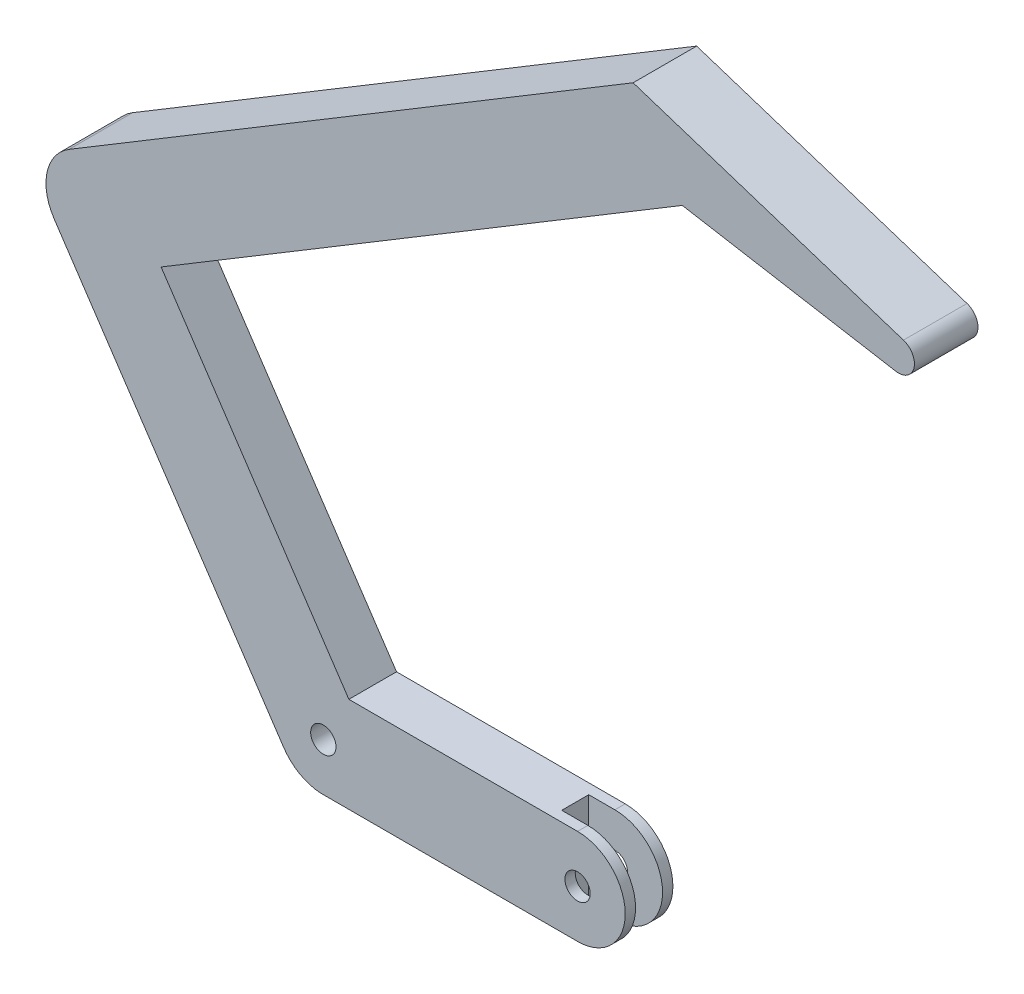
from build123d import *

# Parameters (mm, degrees)
EXTRUDE_1_DEPTH          = 15
CUT_EXTRUDE_1_DEPTH      = 101.747208398
CUT_EXTRUDE_1_DEPTH_BACK = 101.747208398
SKETCH_2_W               = 23.23079143
SKETCH_2_H               = 8.5
CUT_EXTRUDE_2_DEPTH      = 98.33961167
CUT_EXTRUDE_2_DEPTH_BACK = 98.33961167
SKETCH_3_R               = 3.985
EXTRUDE_2_DEPTH          = 15
CUT_EXTRUDE_4_DEPTH      = 157.182605119
CUT_EXTRUDE_4_DEPTH_BACK = 157.182605119
SKETCH_9_R               = 3.985
CUT_EXTRUDE_5_DEPTH      = 157.182605119
CUT_EXTRUDE_5_DEPTH_BACK = 157.182605119
EXTRUDE_5_DEPTH          = 20
FILLET_1_R               = 5


with BuildPart() as part:
    # 草图1 → 凸台-拉伸1 (new body)
    with BuildSketch(Plane.XY):
        with BuildLine():
            Line((0, 15), (80, 15))
            ThreePointArc((80, 15), (95, 0), (80, -15))
            Line((80, -15), (0, -15))
            ThreePointArc((0, -15), (-15, 0), (0, 15))
        make_face()
    extrude(amount=EXTRUDE_1_DEPTH)

    # 草图2 → 切除-拉伸1 (cut, two sides: drawn at the far end of the back side and taken through both)
    with BuildSketch(Plane.XZ.offset(15).offset(-CUT_EXTRUDE_1_DEPTH_BACK)):
        with Locations((83.384604285, 7.5)):
            Rectangle(SKETCH_2_W, SKETCH_2_H)
    extrude(amount=CUT_EXTRUDE_1_DEPTH + CUT_EXTRUDE_1_DEPTH_BACK, mode=Mode.SUBTRACT)

    # 草图3 → 切除-拉伸2 (cut, two sides: drawn at the far end of the back side and taken through both)
    with BuildSketch(Plane(origin=(0, 0, 0), x_dir=(-1, 0, 0), z_dir=(0, 0, -1)).offset(-CUT_EXTRUDE_2_DEPTH_BACK)):
        with Locations((-80, 0)):
            Circle(SKETCH_3_R)
    extrude(amount=CUT_EXTRUDE_2_DEPTH + CUT_EXTRUDE_2_DEPTH_BACK, mode=Mode.SUBTRACT)

    # 草图4 → 凸台-拉伸2 (add)
    with BuildSketch(Plane.XY.offset(15)):
        with BuildLine():
            Line((-12.482779954, -8.354383615), (-84.788603834, 99.682035397))
            ThreePointArc((-84.788603834, 99.682035397), (-80.660207496, 120.519198965), (-59.823043927, 116.390802627))
            Line((-59.823043927, 116.390802627), (12.482779954, 8.354383615))
            ThreePointArc((12.482779954, 8.354383615), (8.354383615, -12.482779954), (-12.482779954, -8.354383615))
        make_face()
    extrude(amount=-EXTRUDE_2_DEPTH)

    # 草图9 → 切除-拉伸4 (cut, two sides: drawn at the far end of the back side and taken through both)
    with BuildSketch(Plane(origin=(0, 0, 0), x_dir=(-1, 0, 0), z_dir=(0, 0, -1)).offset(-CUT_EXTRUDE_4_DEPTH_BACK)):
        Circle(SKETCH_9_R)
    extrude(amount=CUT_EXTRUDE_4_DEPTH + CUT_EXTRUDE_4_DEPTH_BACK, mode=Mode.SUBTRACT)

    # 草图10 → 切除-拉伸5 (cut, two sides: drawn at the far end of the back side and taken through both)
    with BuildSketch(Plane.XY.offset(15).offset(-CUT_EXTRUDE_5_DEPTH_BACK)):
        Polygon((-84.788603834, 99.682035397), (-48.234850364, 123.999680139), (-59.64356033, 141.14900426), (-100.506345589, 113.964745441), (-89.097635623, 96.815421321), align=None)
    extrude(amount=CUT_EXTRUDE_5_DEPTH + CUT_EXTRUDE_5_DEPTH_BACK, mode=Mode.SUBTRACT)

    # 草图11 → 凸台-拉伸5 (add)
    with BuildSketch(Plane.XY.offset(15)):
        with BuildLine():
            Line((97.484212933, 227.748715927), (249.011128895, 178.572894151))
            Line((249.011128895, 178.572894151), (112.956276539, 202.05846487))
            Line((112.956276539, 202.05846487), (-64.546579612, 95.156610362))
            ThreePointArc((-64.546579612, 95.156610362), (-85.127736943, 100.265704087), (-80.018643218, 120.846861419))
            Line((-80.018643218, 120.846861419), (97.484212933, 227.748715927))
        make_face()
    extrude(amount=-EXTRUDE_5_DEPTH)

    # 圆角1
    fillet_1_edges = [part.edges().sort_by_distance(p)[0] for p in [
        (249.011128895, 178.572894151, 5),
    ]]
    fillet(fillet_1_edges, radius=FILLET_1_R)


solid = part.part
